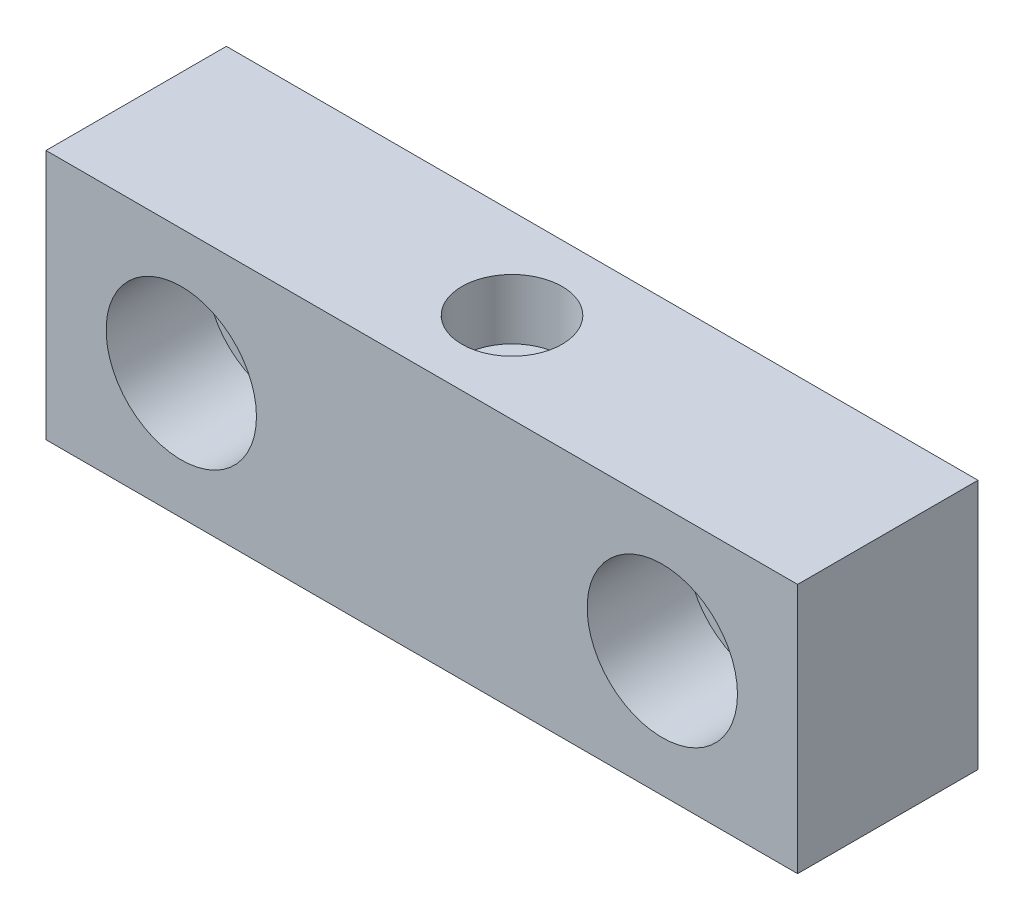
from build123d import *

# Parameters (mm, degrees)
SKETCH1_W           = 75
SKETCH1_H           = 25
BOSS_EXTRUDE1_DEPTH = 18
SKETCH2_R           = 7.5
CUT_EXTRUDE1_DEPTH  = 10
SKETCH3_R           = 2.5
CUT_EXTRUDE2_DEPTH  = 49.53091798
SKETCH4_R           = 5
CUT_EXTRUDE3_DEPTH  = 6


with BuildPart() as part:
    # Sketch1 → Boss-Extrude1 (new body)
    with BuildSketch(Plane.XY):
        Rectangle(SKETCH1_W, SKETCH1_H)
    extrude(amount=BOSS_EXTRUDE1_DEPTH)

    # Sketch2 → Cut-Extrude1 (cut)
    with BuildSketch(Plane.XY.offset(18)):
        with Locations((-24, 0)):
            Circle(SKETCH2_R)
        with Locations((24, 0)):
            Circle(SKETCH2_R)
    extrude(amount=-CUT_EXTRUDE1_DEPTH, mode=Mode.SUBTRACT)

    # Sketch3 → Cut-Extrude2 (cut, through all)
    with BuildSketch(Plane.XZ.offset(12.5)):
        with Locations(Location((0, 9, 0), (0, 0, 270))):
            Circle(SKETCH3_R)
    extrude(amount=-CUT_EXTRUDE2_DEPTH, mode=Mode.SUBTRACT)

    # Sketch4 → Cut-Extrude3 (cut)
    with BuildSketch(Plane(origin=(0, 12.5, 0), x_dir=(1, 0, 0), z_dir=(0, 1, 0))):
        with Locations(Location((0, -9, 0), (0, 0, 270))):
            Circle(SKETCH4_R)
    extrude(amount=-CUT_EXTRUDE3_DEPTH, mode=Mode.SUBTRACT)


solid = part.part
